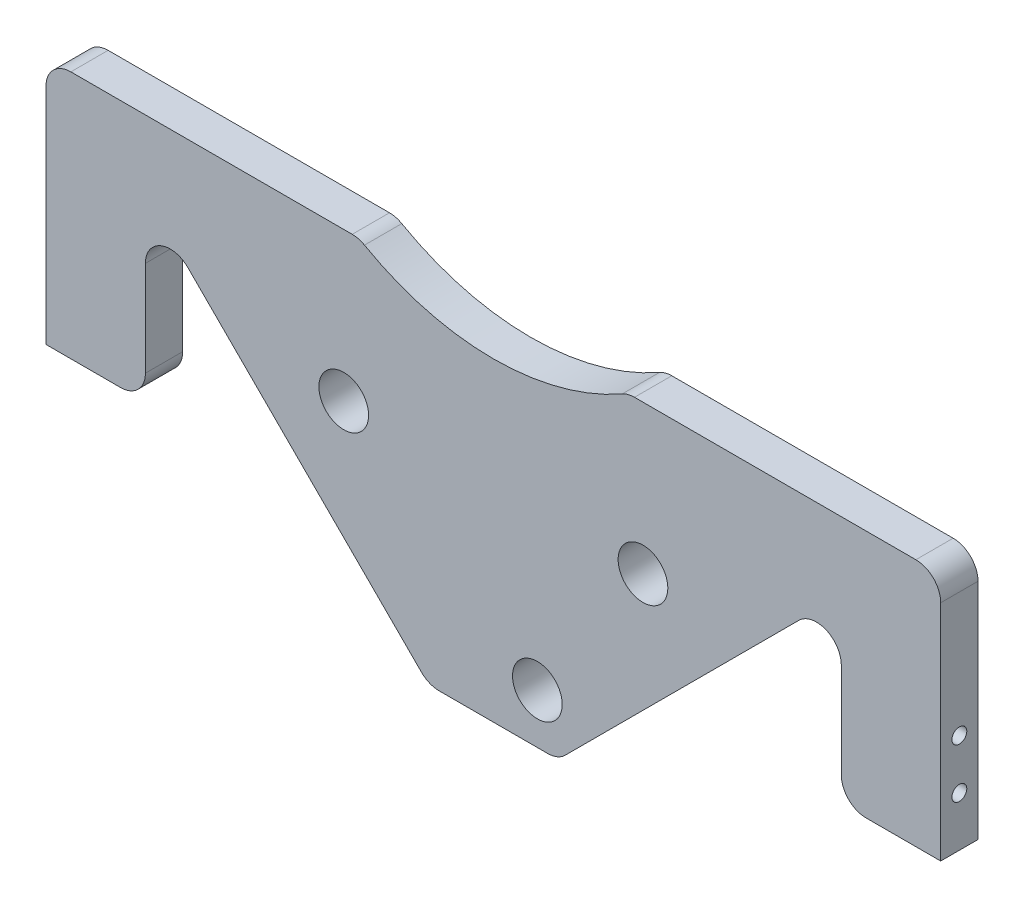
from build123d import *

# Parameters (mm, degrees)
BOSS_EXTRUDE1_DEPTH             = 9.525
F_1_2_0_5_DIAMETER_HOLE1_D      = 12.7
SKETCH7_R                       = 66.675
CUT_EXTRUDE1_DEPTH              = 169.325445566
CUT_EXTRUDE2_DEPTH              = 169.325445566
FILLET1_R                       = 6.35
F_10_24_TAPPED_HOLE1_AT_2_COUNT = 2
F_10_24_TAPPED_HOLE1_AT_2_PITCH = 12.7


with BuildPart() as part:
    # Sketch2 → Boss-Extrude1 (new body)
    with BuildSketch(Plane.XY):
        Polygon((-16.500012242, 33.286517476), (16.500012242, 33.286517476), (42.913494767, 59.7), (114.3, 59.7), (114.3, 123.2), (-114.3, 123.2), (-114.3, 59.7), (-42.913494767, 59.7), align=None)
    extrude(amount=BOSS_EXTRUDE1_DEPTH)

    # 1/2 (0.5) Diameter Hole1 (through all)
    with Locations(Plane.XY.offset(9.525)):
        with Locations((-38.227, 85.227), (38.227, 85.227), (11.2395, 45.986517476)):
            Hole(F_1_2_0_5_DIAMETER_HOLE1_D / 2)

    # Sketch7 → Cut-Extrude1 (cut, through all)
    with BuildSketch(Plane(origin=(0, 0, 0), x_dir=(-1, 0, 0), z_dir=(0, 0, -1))):
        with Locations((0, 180.35)):
            Circle(SKETCH7_R)
    extrude(amount=-CUT_EXTRUDE1_DEPTH, mode=Mode.SUBTRACT)

    # Sketch13 → Cut-Extrude2 (cut, through all)
    with BuildSketch(Plane(origin=(0, 0, 0), x_dir=(-1, 0, 0), z_dir=(0, 0, -1))):
        Polygon((42.913494767, 59.7), (88.9, 105.686505233), (88.9, 59.7), align=None)
        Polygon((-42.913494767, 59.7), (-88.9, 105.686505233), (-88.9, 59.7), align=None)
    extrude(amount=-CUT_EXTRUDE2_DEPTH, mode=Mode.SUBTRACT)

    # Fillet1
    fillet1_edges = [part.edges().sort_by_distance(p)[0] for p in [
        (-114.3, 123.2, 4.7625),
        (114.3, 123.2, 4.7625),
        (34.342875899, 123.2, 4.7625),
        (-34.342875899, 123.2, 4.7625),
        (16.500012242, 33.286517476, 4.7625),
        (-16.500012242, 33.286517476, 4.7625),
        (-88.9, 105.686505233, 4.7625),
        (-88.9, 59.7, 4.7625),
        (88.9, 105.686505233, 4.7625),
        (88.9, 59.7, 4.7625),
    ]]
    fillet(fillet1_edges, radius=FILLET1_R)

    # Sketch12 → #10-24 Tapped Hole1 (revolve, cut)
    with BuildSketch(Plane(origin=(-114.3, 85.1, 4.7625), x_dir=(0, 0, 1), z_dir=(0, 1, 0))):
        Polygon((0, 0), (0, 16.088724014), (1.89865, 14.9479), (1.89865, 0), align=None)
    f_10_24_tapped_hole1 = revolve(axis=Axis((-120.65, 85.1, 4.7625), (1, 0, 0)), mode=Mode.SUBTRACT)

    # #10-24 Tapped Hole1 at 2: #10-24 Tapped Hole1 ×2
    with Locations(*[(0, -i * F_10_24_TAPPED_HOLE1_AT_2_PITCH, 0) for i in range(1, F_10_24_TAPPED_HOLE1_AT_2_COUNT)]):
        add(f_10_24_tapped_hole1, mode=Mode.SUBTRACT)

    # Mirror1: #10-24 Tapped Hole1 across plane
    add(f_10_24_tapped_hole1.mirror(Plane(origin=(0, 0, 0), x_dir=(0, 0, 1), z_dir=(1, 0, 0))), mode=Mode.SUBTRACT)

    # Mirror1 copy 1 sketch → Mirror1 copy 1 (revolve, cut)
    with BuildSketch(Plane(origin=(114.3, 72.4, 4.7625), x_dir=(0, 0, 1), z_dir=(0, 1, 0))):
        Polygon((0, 0), (0, -16.088724014), (1.89865, -14.9479), (1.89865, 0), align=None)
    revolve(axis=Axis((120.65, 72.4, 4.7625), (1, 0, 0)), mode=Mode.SUBTRACT)


solid = part.part
